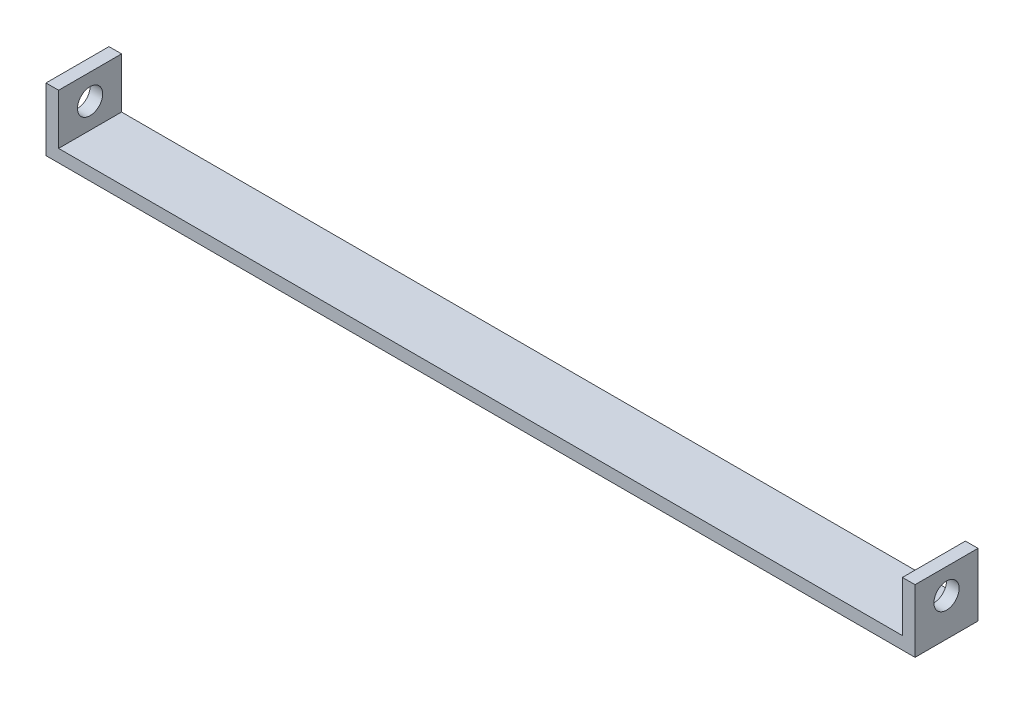
from build123d import *

# Parameters (mm, degrees)
BOSS_EXTRUDE1_DEPTH = 10
SKETCH3_R           = 2
CUT_EXTRUDE2_DEPTH  = 136


with BuildPart() as part:
    # Sketch1 → Boss-Extrude1 (new body)
    with BuildSketch(Plane.XY):
        Polygon((0, 0), (138, 0), (138, 10), (136, 10), (136, 2), (2, 2), (2, 10), (0, 10), align=None)
    extrude(amount=BOSS_EXTRUDE1_DEPTH)

    # Sketch3 → Cut-Extrude2 (cut)
    with BuildSketch(Plane.ZY):
        with Locations(Location((5, 6, 0), (0, 0, 270))):
            Circle(SKETCH3_R)
    cut_extrude2 = extrude(amount=-CUT_EXTRUDE2_DEPTH, mode=Mode.SUBTRACT)

    # Mirror1: Cut-Extrude2 across plane
    add(cut_extrude2.mirror(Plane.ZY.offset(-69)), mode=Mode.SUBTRACT)


solid = part.part
